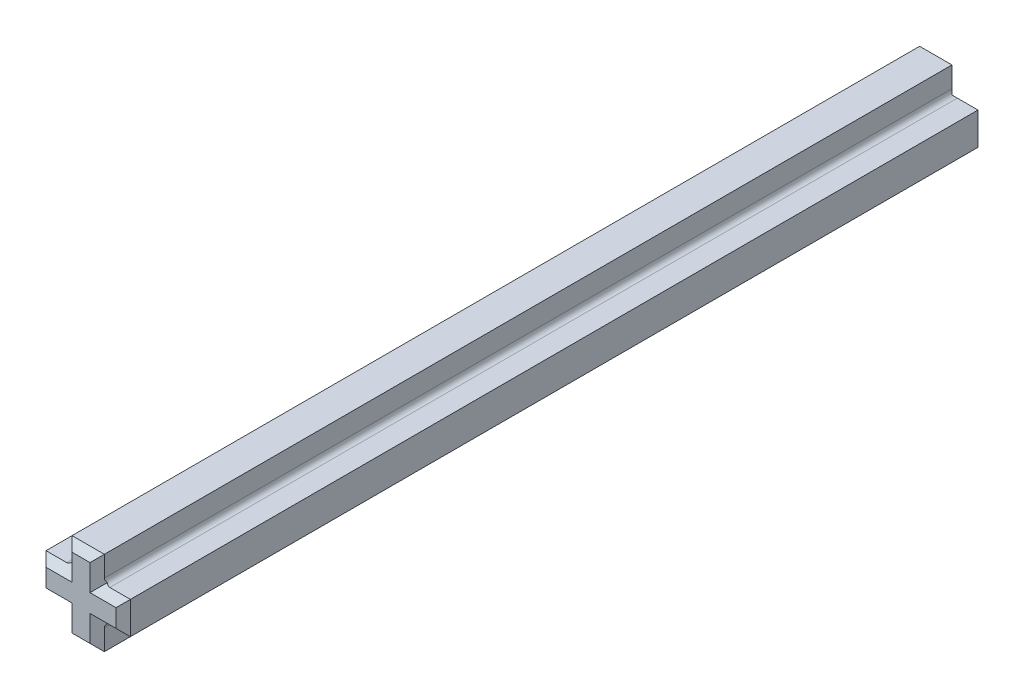
from build123d import *

# Parameters (mm, degrees)
BOSS_EXTRUDE1_DEPTH = 24
CHAMFER1_SIZE       = 0.4
FILLET1_R           = 0.3


with BuildPart() as part:
    # Sketch1 → Boss-Extrude1 (new, symmetric)
    with BuildSketch(Plane.XY):
        Polygon((0.9, -0.9), (0.9, -2.35), (-0.9, -2.35), (-0.9, -0.9), (-2.35, -0.9), (-2.35, 0.9), (-0.9, 0.9), (-0.9, 2.35), (0.9, 2.35), (0.9, 0.9), (2.35, 0.9), (2.35, -0.9), align=None)
    extrude(amount=BOSS_EXTRUDE1_DEPTH, both=True)

    # Chamfer1
    chamfer1_edges = [part.edges().sort_by_distance(p)[0] for p in [
        (0.9, -1.625, -24),
        (0, -2.35, -24),
        (1.625, 0.9, 24),
        (-0.9, -1.625, -24),
        (-1.625, -0.9, -24),
        (-2.35, 0, -24),
        (-1.625, 0.9, -24),
        (-0.9, 1.625, -24),
        (0, 2.35, -24),
        (0.9, 1.625, -24),
        (1.625, 0.9, -24),
        (2.35, 0, -24),
        (1.625, -0.9, -24),
        (0.9, 1.625, 24),
        (0, 2.35, 24),
        (-0.9, 1.625, 24),
        (-1.625, 0.9, 24),
        (-2.35, 0, 24),
        (-1.625, -0.9, 24),
        (-0.9, -1.625, 24),
        (0, -2.35, 24),
        (0.9, -1.625, 24),
        (1.625, -0.9, 24),
        (2.35, 0, 24),
    ]]
    chamfer(chamfer1_edges, length=CHAMFER1_SIZE)

    # Fillet1
    fillet1_edges = [part.edges().sort_by_distance(p)[0] for p in [
        (0.9, 0.9, 0),
        (-0.9, 0.9, 0),
        (-0.9, -0.9, 0),
        (0.9, -0.9, 0),
    ]]
    fillet(fillet1_edges, radius=FILLET1_R)


solid = part.part
